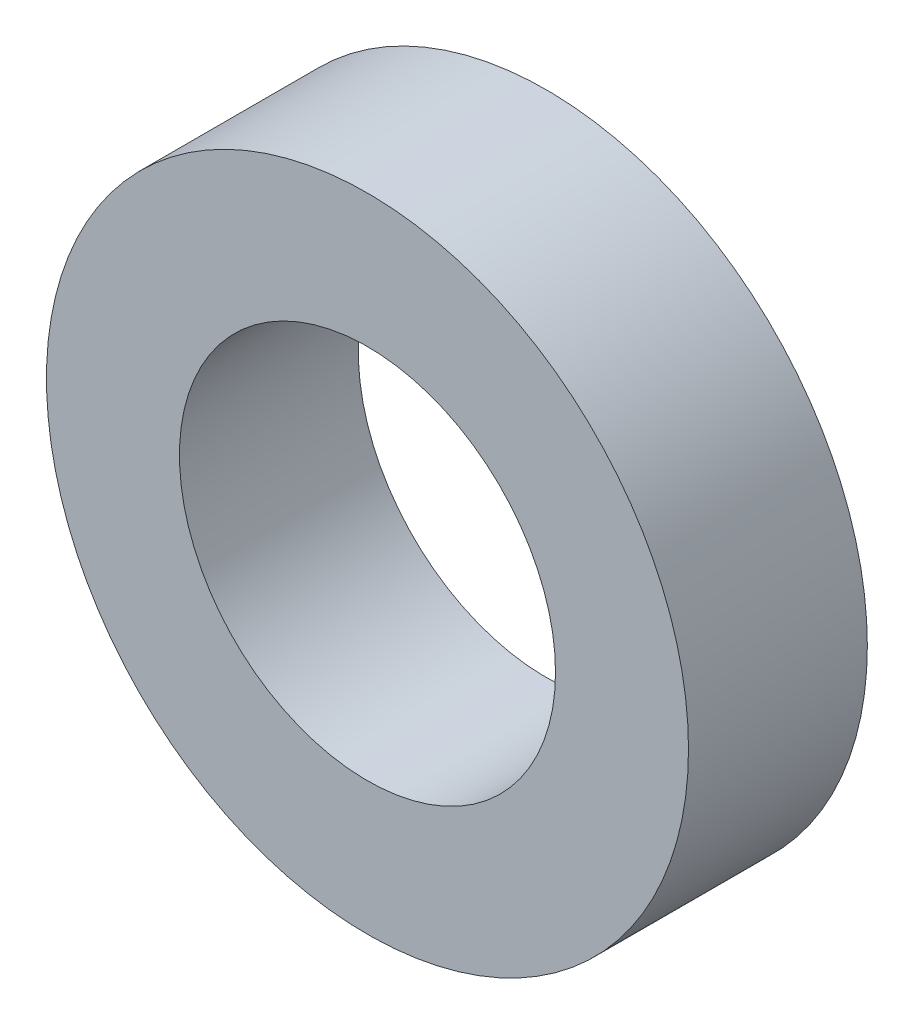
from build123d import *

# Parameters (mm, degrees)
SKETCH1_R           = 14.224
BOSS_EXTRUDE1_DEPTH = 7.9248
SKETCH2_R           = 8.3312
CUT_EXTRUDE1_DEPTH  = 7.9248


with BuildPart() as part:
    # Sketch1 → Boss-Extrude1 (new body)
    with BuildSketch(Plane.XY):
        Circle(SKETCH1_R)
    extrude(amount=BOSS_EXTRUDE1_DEPTH)

    # Sketch2 → Cut-Extrude1 (cut)
    with BuildSketch(Plane.XY):
        Circle(SKETCH2_R)
    extrude(amount=CUT_EXTRUDE1_DEPTH, mode=Mode.SUBTRACT)


solid = part.part
